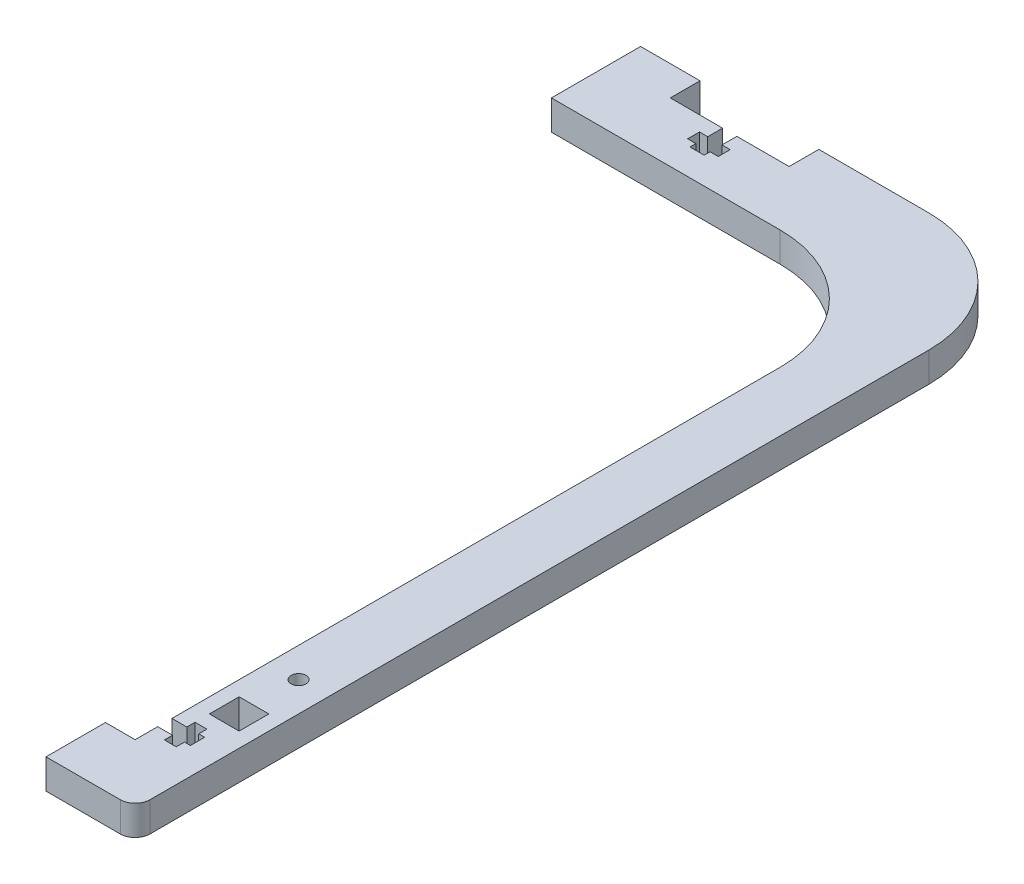
from build123d import *

# Parameters (mm, degrees)
SKETCH1_R           = 1.5875
BOSS_EXTRUDE1_DEPTH = 6.35


with BuildPart() as part:
    # Sketch1 → Boss-Extrude1 (new body)
    with BuildSketch(Plane(origin=(0, 0, 0), x_dir=(1, 0, 0), z_dir=(0, 1, 0))):
        with BuildLine():
            Line((44.353069229, 10.812409235), (44.353069229, -114.358790765))
            Line((44.353069229, -114.358790765), (44.353069229, -119.184861087))
            Line((44.353069229, -119.184861087), (47.528069229, -119.184861087))
            Line((47.528069229, -119.184861087), (47.528069229, -117.432261087))
            Line((47.528069229, -117.432261087), (50.068069229, -117.432261087))
            Line((50.068069229, -117.432261087), (50.068069229, -119.184861087))
            Line((50.068069229, -119.184861087), (51.338069229, -119.184861087))
            Line((51.338069229, -119.184861087), (51.338069229, -122.232720443))
            Line((51.338069229, -122.232720443), (50.068069229, -122.232720443))
            Line((50.068069229, -122.232720443), (50.068069229, -123.985320443))
            Line((50.068069229, -123.985320443), (47.528069229, -123.985320443))
            Line((47.528069229, -123.985320443), (47.528069229, -122.232720443))
            Line((47.528069229, -122.232720443), (44.353069229, -122.232720443))
            Line((44.353069229, -122.232720443), (44.353069229, -127.058790765))
            Line((44.353069229, -127.058790765), (38.003069229, -127.058790765))
            Line((38.003069229, -127.058790765), (38.003069229, -139.758790765))
            Line((38.003069229, -139.758790765), (44.353069229, -139.758790765))
            Line((44.353069229, -139.758790765), (53.878069229, -139.758790765))
            ThreePointArc((53.878069229, -139.758790765), (56.12313326, -138.828854795), (57.053069229, -136.583790765))
            Line((57.053069229, -136.583790765), (57.053069229, 29.862409235))
            ThreePointArc((57.053069229, 29.862409235), (49.613581472, 47.822921477), (31.653069229, 55.262409235))
            Line((31.653069229, 55.262409235), (8.158069229, 55.262409235))
            Line((8.158069229, 55.262409235), (8.158069229, 48.912409235))
            Line((8.158069229, 48.912409235), (-3.018001093, 48.912409235))
            Line((-3.018001093, 48.912409235), (-3.018001093, 45.737409235))
            Line((-3.018001093, 45.737409235), (-1.265401093, 45.737409235))
            Line((-1.265401093, 45.737409235), (-1.265401093, 43.197409235))
            Line((-1.265401093, 43.197409235), (-3.018001093, 43.197409235))
            Line((-3.018001093, 43.197409235), (-3.018001093, 41.927409235))
            Line((-3.018001093, 41.927409235), (-6.065860449, 41.927409235))
            Line((-6.065860449, 41.927409235), (-6.065860449, 43.197409235))
            Line((-6.065860449, 43.197409235), (-7.818460449, 43.197409235))
            Line((-7.818460449, 43.197409235), (-7.818460449, 45.737409235))
            Line((-7.818460449, 45.737409235), (-6.065860449, 45.737409235))
            Line((-6.065860449, 45.737409235), (-6.065860449, 48.912409235))
            Line((-6.065860449, 48.912409235), (-17.241930771, 48.912409235))
            Line((-17.241930771, 48.912409235), (-17.241930771, 55.262409235))
            Line((-17.241930771, 55.262409235), (-29.941930771, 55.262409235))
            Line((-29.941930771, 55.262409235), (-29.941930771, 36.212409235))
            Line((-29.941930771, 36.212409235), (18.953069229, 36.212409235))
            ThreePointArc((18.953069229, 36.212409235), (36.913581472, 28.772921477), (44.353069229, 10.812409235))
        make_face()
        with Locations(Location((50.703069229, -98.483790765, 0), (0, 0, 270))):
            Circle(SKETCH1_R, mode=Mode.SUBTRACT)
        Polygon((50.703069229, -114.358790765), (47.528069229, -114.358790765), (47.528069229, -108.008790765), (53.878069229, -108.008790765), (53.878069229, -114.358790765), align=None, mode=Mode.SUBTRACT)
    extrude(amount=BOSS_EXTRUDE1_DEPTH)


solid = part.part
